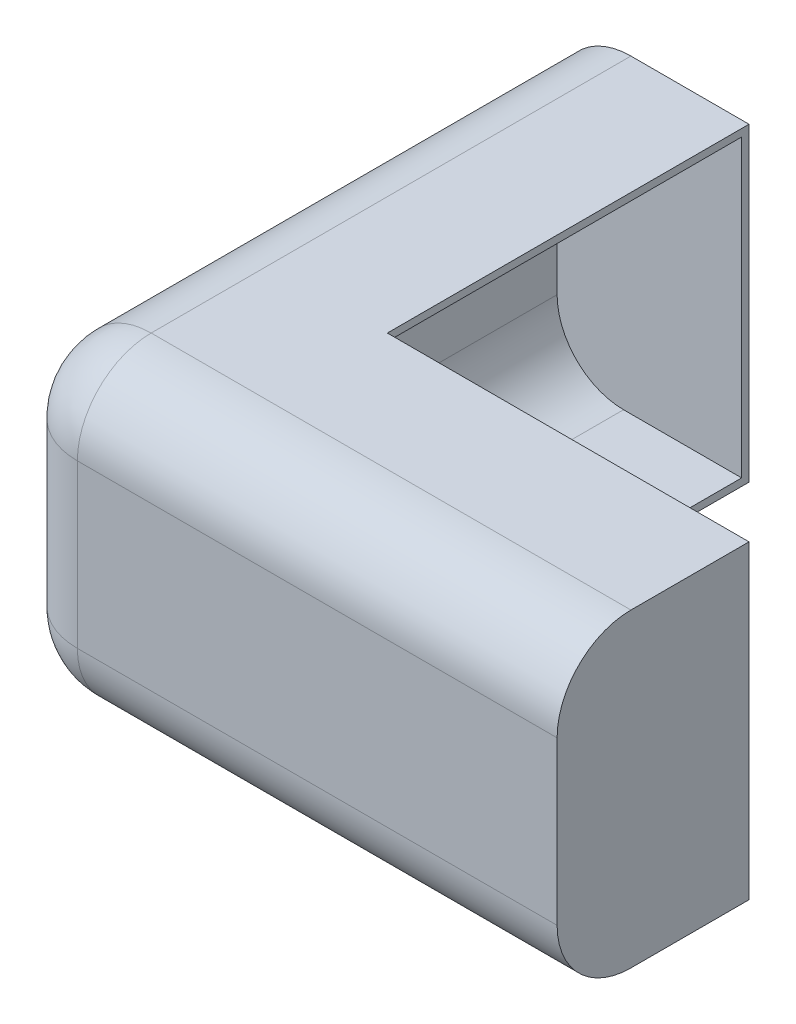
from build123d import *

# Parameters (mm, degrees)
BOSS_EXTRUDE1_DEPTH = 133.35
FILLET1_R           = 31.75
SHELL1_T            = -3.175


with BuildPart() as part:
    # Sketch1 → Boss-Extrude1 (new body)
    with BuildSketch(Plane(origin=(0, 0, 0), x_dir=(1, 0, 0), z_dir=(0, 1, 0))):
        Polygon((0, 0), (0, 155.575), (-82.55, 155.575), (-82.55, -82.55), (155.575, -82.55), (155.575, 0), align=None)
    extrude(amount=BOSS_EXTRUDE1_DEPTH)

    # Fillet1
    fillet1_edges = [part.edges().sort_by_distance(p)[0] for p in [
        (-82.55, 66.675, 82.55),
        (-82.55, 133.35, -36.5125),
        (36.5125, 133.35, 82.55),
        (36.5125, 0, 82.55),
        (-82.55, 0, -36.5125),
    ]]
    fillet(fillet1_edges, radius=FILLET1_R)

    # Shell1
    shell1_openings = [part.faces().sort_by_distance(p)[0] for p in [
        (0, 66.675, -77.7875),
        (77.7875, 66.675, 0),
    ]]
    offset(amount=SHELL1_T, openings=shell1_openings, kind=Kind.INTERSECTION)


solid = part.part
